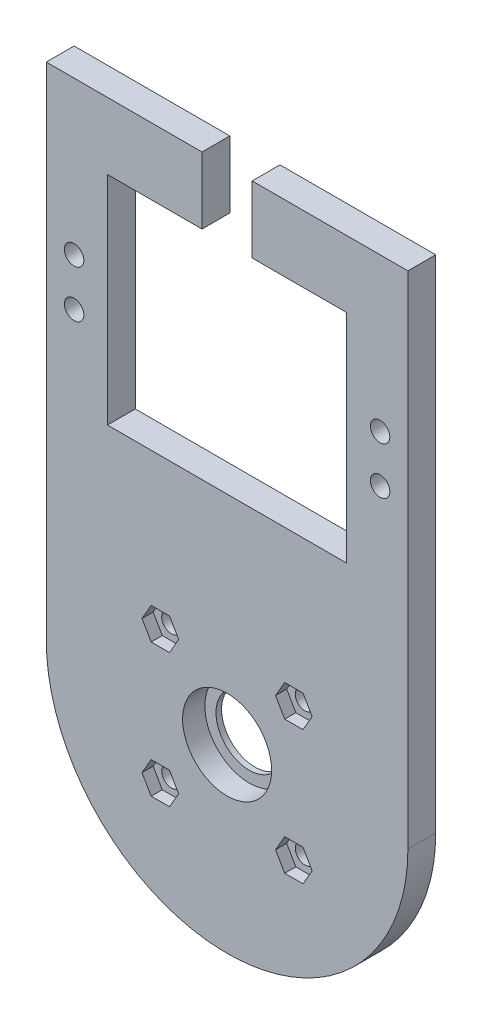
from build123d import *

# Parameters (mm, degrees)
BOSS_EXTRUDE1_DEPTH = 5
SKETCH2_R           = 6
CUT_EXTRUDE1_DEPTH  = 96.818839484
SKETCH3_R           = 8
CUT_EXTRUDE2_DEPTH  = 4
SKETCH4_R           = 1.75
CUT_EXTRUDE3_DEPTH  = 96.818839484
CUT_EXTRUDE4_DEPTH  = 96.818839484
CUT_EXTRUDE6_DEPTH  = 2
SKETCH8_R           = 1.75
CUT_EXTRUDE7_DEPTH  = 96.818839484


with BuildPart() as part:
    # Sketch1 → Boss-Extrude1 (new body)
    with BuildSketch(Plane.XY):
        with BuildLine():
            Line((-32.5, 0), (-32.5, 90))
            Line((-32.5, 90), (32.5, 90))
            Line((32.5, 90), (32.5, 0))
            ThreePointArc((32.5, 0), (0, -32.5), (-32.5, 0))
        make_face()
    extrude(amount=BOSS_EXTRUDE1_DEPTH)

    # Sketch2 → Cut-Extrude1 (cut, through all)
    with BuildSketch(Plane.XY.offset(5)):
        Circle(SKETCH2_R)
    extrude(amount=-CUT_EXTRUDE1_DEPTH, mode=Mode.SUBTRACT)

    # Sketch3 → Cut-Extrude2 (cut)
    with BuildSketch(Plane.XY.offset(5)):
        Circle(SKETCH3_R)
    extrude(amount=-CUT_EXTRUDE2_DEPTH, mode=Mode.SUBTRACT)

    # Sketch4 → Cut-Extrude3 (cut, through all)
    with BuildSketch(Plane.XY.offset(5)):
        with Locations((-12, 12)):
            Circle(SKETCH4_R)
        with Locations(Location((12, 12, 0), (0, 0, 180))):
            Circle(SKETCH4_R)
        with Locations((12, -12)):
            Circle(SKETCH4_R)
        with Locations(Location((-12, -12, 0), (0, 0, 180))):
            Circle(SKETCH4_R)
    extrude(amount=-CUT_EXTRUDE3_DEPTH, mode=Mode.SUBTRACT)

    # Sketch5 → Cut-Extrude4 (cut, through all)
    with BuildSketch(Plane.XY.offset(5)):
        Polygon((-21.5, 78), (-4.504076159, 78), (-4.504076159, 90), (4.504076159, 90), (4.504076159, 78), (21.5, 78), (21.5, 39), (-21.5, 39), align=None)
    extrude(amount=-CUT_EXTRUDE4_DEPTH, mode=Mode.SUBTRACT)

    # Sketch7 → Cut-Extrude6 (cut)
    with BuildSketch(Plane.XY.offset(5)):
        Polygon((-8.709103466, 12), (-10.354551733, 14.85), (-13.645448267, 14.85), (-15.290896534, 12), (-13.645448267, 9.15), (-10.354551733, 9.15), align=None)
        Polygon((10.354551733, 9.15), (8.709103466, 12), (10.354551733, 14.85), (13.645448267, 14.85), (15.290896534, 12), (13.645448267, 9.15), align=None)
        Polygon((8.709103466, -12), (10.354551733, -14.85), (13.645448267, -14.85), (15.290896534, -12), (13.645448267, -9.15), (10.354551733, -9.15), align=None)
        Polygon((-10.354551733, -9.15), (-8.709103466, -12), (-10.354551733, -14.85), (-13.645448267, -14.85), (-15.290896534, -12), (-13.645448267, -9.15), align=None)
    extrude(amount=-CUT_EXTRUDE6_DEPTH, mode=Mode.SUBTRACT)

    # Sketch8 → Cut-Extrude7 (cut, through all)
    with BuildSketch(Plane(origin=(0, 0, 0), x_dir=(-1, 0, 0), z_dir=(0, 0, -1))):
        with Locations((-27.5, 62.5)):
            Circle(SKETCH8_R)
        with Locations((-27.5, 54)):
            Circle(SKETCH8_R)
        with Locations(Location((27.5, 54, 0), (0, 0, 180))):
            Circle(SKETCH8_R)
        with Locations(Location((27.5, 62.5, 0), (0, 0, 180))):
            Circle(SKETCH8_R)
    extrude(amount=-CUT_EXTRUDE7_DEPTH, mode=Mode.SUBTRACT)


solid = part.part
